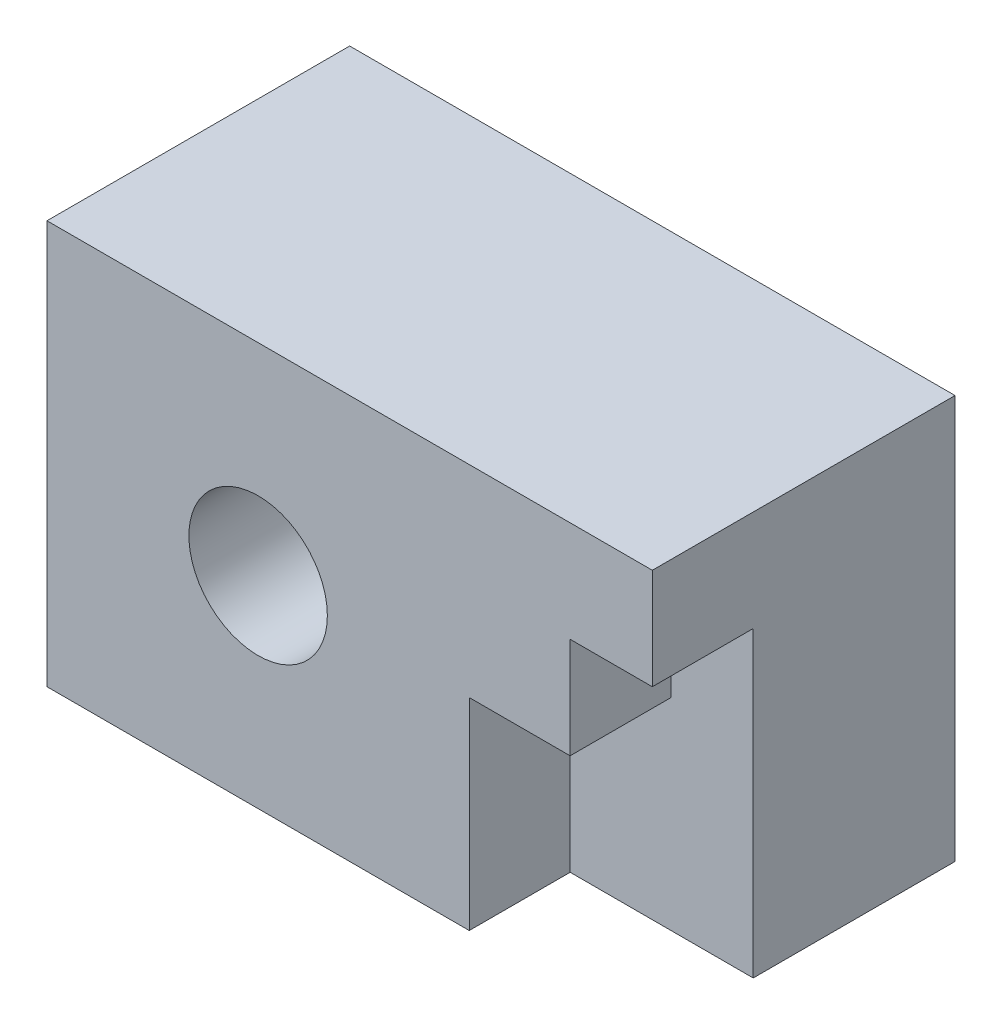
from build123d import *

# Parameters (mm, degrees)
SKETCH1_W           = 60
SKETCH1_H           = 40
BOSS_EXTRUDE1_DEPTH = 30
CUT_EXTRUDE1_DEPTH  = 10
SKETCH3_R           = 6.863550386
CUT_EXTRUDE2_DEPTH  = 31


with BuildPart() as part:
    # Sketch1 → Boss-Extrude1 (new body)
    with BuildSketch(Plane.XY):
        with Locations((30, 20)):
            Rectangle(SKETCH1_W, SKETCH1_H)
    extrude(amount=BOSS_EXTRUDE1_DEPTH)

    # Sketch2 → Cut-Extrude1 (cut)
    with BuildSketch(Plane.XY.offset(30)):
        Polygon((41.853267601, 0), (41.853267601, 20), (51.853267601, 20), (51.853267601, 30), (60, 30), (60, 0), align=None)
    extrude(amount=-CUT_EXTRUDE1_DEPTH, mode=Mode.SUBTRACT)

    # Sketch3 → Cut-Extrude2 (cut)
    with BuildSketch(Plane.XY.offset(30)):
        with Locations((20.926633801, 20)):
            Circle(SKETCH3_R)
    extrude(amount=-CUT_EXTRUDE2_DEPTH, mode=Mode.SUBTRACT)


solid = part.part
